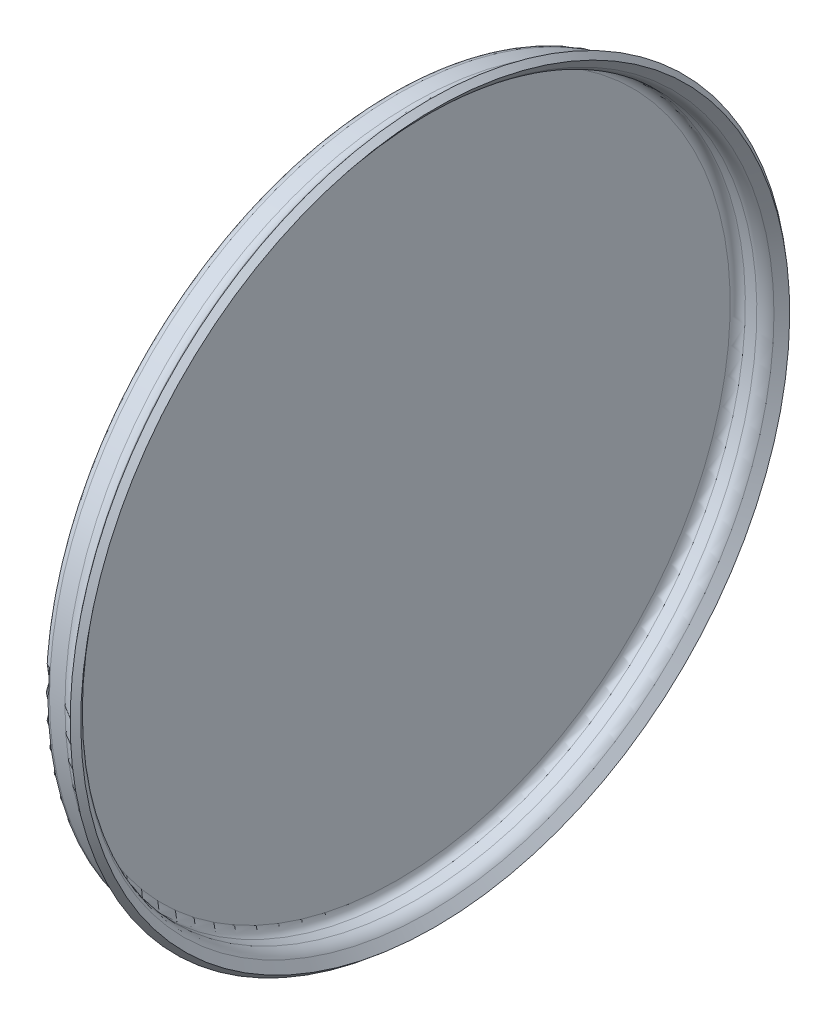
from build123d import *

# Parameters (mm, degrees)
SKETCH_2_R          = 36.366400699
CUT_EXTRUDE_1_DEPTH = 16
SKETCH_3_R          = 34.490812752
EXTRUDE_1_DEPTH     = 1


with BuildPart() as part:
    # 草图1 → 旋转1 (revolve)
    with BuildSketch(Plane.XY):
        with BuildLine():
            Line((-38.083747267, -28.5), (-32.083747267, -28.5))
            ThreePointArc((-32.083747267, -28.5), (-30.669533704, -29.085786438), (-30.083747267, -30.5))
            Line((-30.083747267, -30.5), (-30.083747267, -44))
            ThreePointArc((-30.083747267, -44), (-29.790854048, -44.707106781), (-29.083747267, -45))
            Line((-29.083747267, -45), (-27.565467955, -45))
            ThreePointArc((-27.565467955, -45), (-26.713721936, -45.190434107), (-26.02417741, -45.72547128))
            Line((-26.02417741, -45.72547128), (-25.083747267, -46.86273564))
            Line((-25.083747267, -46.86273564), (-25.854392539, -47.5))
            Line((-25.854392539, -47.5), (-26.494868211, -46.72547128))
            ThreePointArc((-26.494868211, -46.72547128), (-27.184412737, -46.190434107), (-28.036158755, -46))
            Line((-28.036158755, -46), (-30.083747267, -46))
            ThreePointArc((-30.083747267, -46), (-30.790854048, -45.707106781), (-31.083747267, -45))
            Line((-31.083747267, -45), (-31.083747267, -31.5))
            ThreePointArc((-31.083747267, -31.5), (-31.669533704, -30.085786438), (-33.083747267, -29.5))
            Line((-33.083747267, -29.5), (-37.083747267, -29.5))
            ThreePointArc((-37.083747267, -29.5), (-37.790854048, -29.207106781), (-38.083747267, -28.5))
        make_face()
    revolve(axis=Axis((-28.083747267, 0, 0), (1, 0, 0)))

    # 草图2 → 切除-拉伸1 (cut)
    with BuildSketch(Plane.ZY.offset(31.083747267)):
        Circle(SKETCH_2_R)
    extrude(amount=CUT_EXTRUDE_1_DEPTH, mode=Mode.SUBTRACT)

    # 草图3 → 凸台-拉伸1 (add)
    with BuildSketch(Plane.ZY.offset(31.083747267)):
        Circle(SKETCH_3_R)
    extrude(amount=-EXTRUDE_1_DEPTH)


solid = part.part
